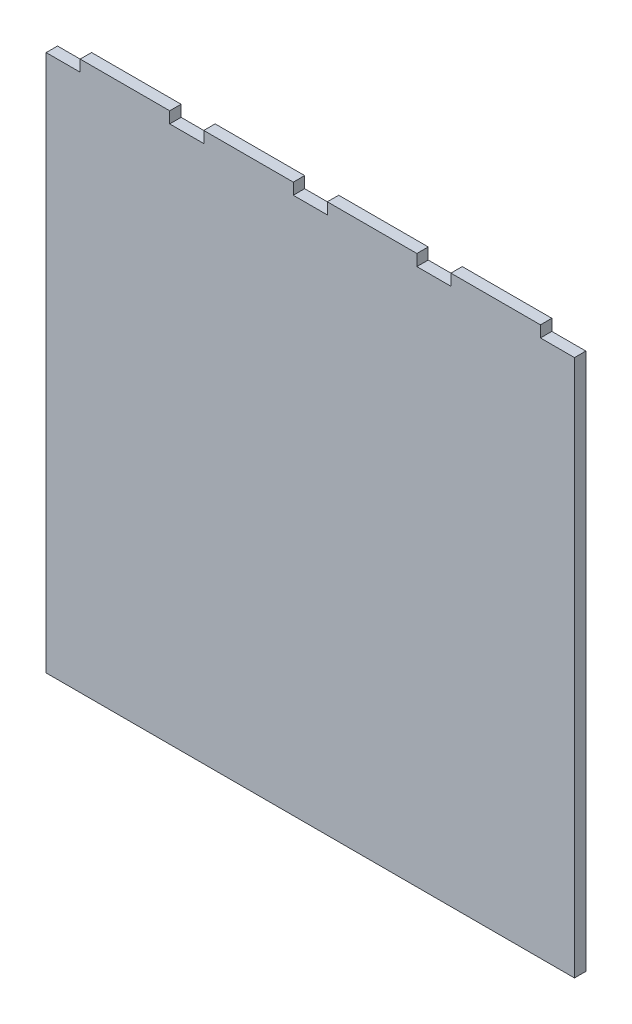
from build123d import *

# Parameters (mm, degrees)
BOSS_EXTRUDE1_DEPTH = 6.35


with BuildPart() as part:
    # Sketch2 → Boss-Extrude1 (new body)
    with BuildSketch(Plane.XY):
        Polygon((0, 0), (19, 0), (19, 6.35), (69, 6.35), (69, 0), (88, 0), (88, 6.35), (138, 6.35), (138, 0), (157, 0), (157, 6.35), (207, 6.35), (207, 0), (226, 0), (226, 6.35), (276, 6.35), (276, 0), (295, 0), (295, -300), (0, -300), align=None)
    extrude(amount=BOSS_EXTRUDE1_DEPTH)


solid = part.part
